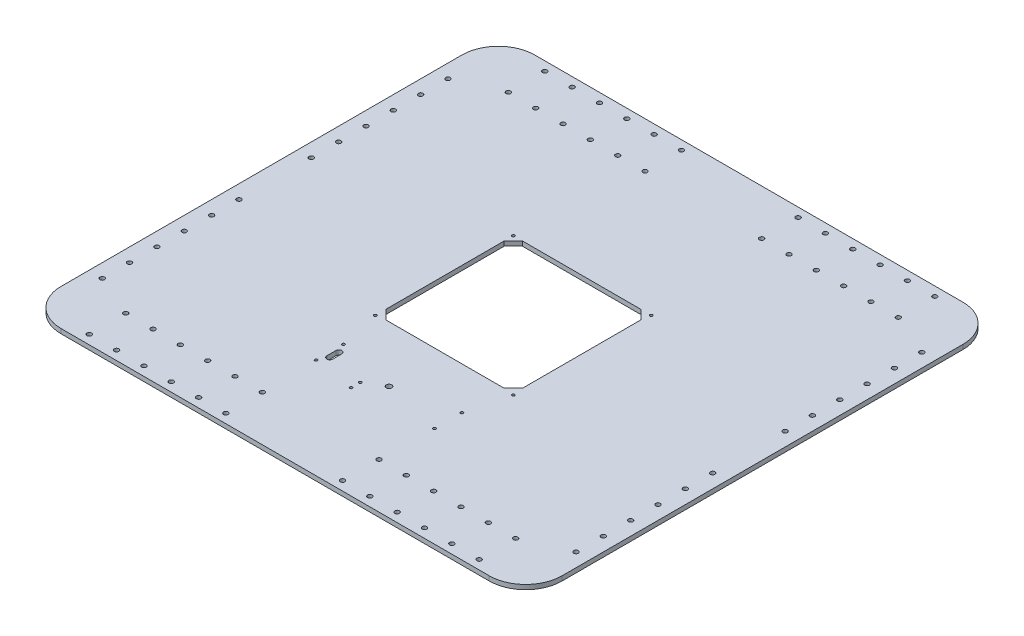
from build123d import *

# Parameters (mm, degrees)
SKETCH1_R           = 2.999999999
SKETCH1_R_2         = 1.5
SKETCH1_R_3         = 1.499999999
BOSS_EXTRUDE1_DEPTH = 5
SKETCH4_R           = 2.5
CUT_EXTRUDE1_DEPTH  = 757.918093325


with BuildPart() as part:
    # Sketch1 → Boss-Extrude1 (new body)
    with BuildSketch(Plane(origin=(0, 0, 0), x_dir=(1, 0, 0), z_dir=(0, 1, 0))):
        with BuildLine():
            Line((40, 0), (510.000000002, 0))
            ThreePointArc((510.000000002, 0), (538.28427125, 11.715728753), (550.000000002, 40))
            Line((550.000000002, 40), (550.000000002, 480))
            ThreePointArc((550.000000002, 480), (538.28427125, 508.284271247), (510.000000002, 520))
            Line((510.000000002, 520), (40, 520))
            ThreePointArc((40, 520), (11.715728753, 508.284271247), (0, 480))
            Line((0, 480), (0, 40))
            ThreePointArc((0, 40), (11.715728753, 11.715728753), (40, 0))
        make_face()
        with Locations(Location((275.000000001, 125, 0), (0, 0, 270))):
            Circle(SKETCH1_R, mode=Mode.SUBTRACT)
        with Locations(Location((200.000000001, 336.45643718, 0), (0, 0, 270))):
            Circle(SKETCH1_R_2, mode=Mode.SUBTRACT)
        with Locations(Location((351.456437186, 336.45643718, 0), (0, 0, 270))):
            Circle(SKETCH1_R_2, mode=Mode.SUBTRACT)
        with Locations(Location((351.456437186, 184.999999996, 0), (0, 0, 270))):
            Circle(SKETCH1_R_2, mode=Mode.SUBTRACT)
        with Locations(Location((200.000000001, 184.999999996, 0), (0, 0, 270))):
            Circle(SKETCH1_R_2, mode=Mode.SUBTRACT)
        with Locations(Location((255.405759863, 113, 0), (0, 0, 270))):
            Circle(SKETCH1_R_2, mode=Mode.SUBTRACT)
        with Locations(Location((210.000000001, 110, 0), (0, 0, 270))):
            Circle(SKETCH1_R_3, mode=Mode.SUBTRACT)
        with Locations(Location((255.405759863, 103, 0), (0, 0, 270))):
            Circle(SKETCH1_R_2, mode=Mode.SUBTRACT)
        with Locations(Location((340.000000001, 140, 0), (0, 0, 270))):
            Circle(SKETCH1_R_3, mode=Mode.SUBTRACT)
        with Locations(Location((210.000000001, 140, 0), (0, 0, 270))):
            Circle(SKETCH1_R_3, mode=Mode.SUBTRACT)
        with Locations(Location((340.000000001, 110, 0), (0, 0, 270))):
            Circle(SKETCH1_R_3, mode=Mode.SUBTRACT)
        Polygon((200.000000001, 326.45643718), (210.000000001, 336.45643718), (340.000000001, 336.45643718), (350.000000001, 326.45643718), (350.000000001, 196.45643718), (340.000000001, 186.45643718), (210.000000001, 186.45643718), (200.000000001, 196.45643718), align=None, mode=Mode.SUBTRACT)
        with BuildLine():
            Line((218.220285237, 120), (218.220285237, 130))
            ThreePointArc((218.220285237, 130), (215.000000001, 133.220285235), (211.779714766, 130))
            Line((211.779714766, 130), (211.779714766, 120))
            ThreePointArc((211.779714766, 120), (215.000000001, 116.779714765), (218.220285237, 120))
        make_face(mode=Mode.SUBTRACT)
    extrude(amount=BOSS_EXTRUDE1_DEPTH)

    # Sketch4 → Cut-Extrude1 (cut, through all)
    with BuildSketch(Plane(origin=(0, 5, 0), x_dir=(1, 0, 0), z_dir=(0, 1, 0))):
        with Locations(Location((535, 70.266316246, 0), (0, 0, 90))):
            Circle(SKETCH4_R)
        with Locations(Location((488.994609259, 10, 0), (0, 0, 90))):
            Circle(SKETCH4_R)
        with Locations(Location((488.994609259, 50, 0), (0, 0, 90))):
            Circle(SKETCH4_R)
        with Locations(Location((535, 100.266316246, 0), (0, 0, 90))):
            Circle(SKETCH4_R)
        with Locations(Location((535, 130.266316246, 0), (0, 0, 90))):
            Circle(SKETCH4_R)
        with Locations(Location((535, 160.266316246, 0), (0, 0, 90))):
            Circle(SKETCH4_R)
        with Locations(Location((535, 190.266316246, 0), (0, 0, 90))):
            Circle(SKETCH4_R)
        with Locations(Location((535, 220.266316246, 0), (0, 0, 90))):
            Circle(SKETCH4_R)
        with Locations(Location((458.994609259, 50, 0), (0, 0, 90))):
            Circle(SKETCH4_R)
        with Locations(Location((458.994609259, 10, 0), (0, 0, 90))):
            Circle(SKETCH4_R)
        with Locations(Location((428.994609259, 50, 0), (0, 0, 90))):
            Circle(SKETCH4_R)
        with Locations(Location((428.994609259, 10, 0), (0, 0, 90))):
            Circle(SKETCH4_R)
        with Locations(Location((398.994609259, 50, 0), (0, 0, 90))):
            Circle(SKETCH4_R)
        with Locations(Location((398.994609259, 10, 0), (0, 0, 90))):
            Circle(SKETCH4_R)
        with Locations(Location((368.994609259, 50, 0), (0, 0, 90))):
            Circle(SKETCH4_R)
        with Locations(Location((368.994609259, 10, 0), (0, 0, 90))):
            Circle(SKETCH4_R)
        with Locations(Location((338.994609259, 50, 0), (0, 0, 90))):
            Circle(SKETCH4_R)
        with Locations(Location((338.994609259, 10, 0), (0, 0, 90))):
            Circle(SKETCH4_R)
        with Locations(Location((338.994609259, 510, 0), (0, 0, 270))):
            Circle(SKETCH4_R)
        with Locations(Location((338.994609259, 470, 0), (0, 0, 270))):
            Circle(SKETCH4_R)
        with Locations(Location((368.994609259, 510, 0), (0, 0, 270))):
            Circle(SKETCH4_R)
        with Locations(Location((368.994609259, 470, 0), (0, 0, 270))):
            Circle(SKETCH4_R)
        with Locations(Location((398.994609259, 510, 0), (0, 0, 270))):
            Circle(SKETCH4_R)
        with Locations(Location((398.994609259, 470, 0), (0, 0, 270))):
            Circle(SKETCH4_R)
        with Locations(Location((428.994609259, 510, 0), (0, 0, 270))):
            Circle(SKETCH4_R)
        with Locations(Location((428.994609259, 470, 0), (0, 0, 270))):
            Circle(SKETCH4_R)
        with Locations(Location((458.994609259, 510, 0), (0, 0, 270))):
            Circle(SKETCH4_R)
        with Locations(Location((458.994609259, 470, 0), (0, 0, 270))):
            Circle(SKETCH4_R)
        with Locations(Location((535, 299.733683754, 0), (0, 0, 270))):
            Circle(SKETCH4_R)
        with Locations(Location((535, 329.733683754, 0), (0, 0, 270))):
            Circle(SKETCH4_R)
        with Locations(Location((535, 359.733683754, 0), (0, 0, 270))):
            Circle(SKETCH4_R)
        with Locations(Location((535, 389.733683754, 0), (0, 0, 270))):
            Circle(SKETCH4_R)
        with Locations(Location((535, 419.733683754, 0), (0, 0, 270))):
            Circle(SKETCH4_R)
        with Locations(Location((488.994609259, 470, 0), (0, 0, 270))):
            Circle(SKETCH4_R)
        with Locations(Location((488.994609259, 510, 0), (0, 0, 270))):
            Circle(SKETCH4_R)
        with Locations(Location((535, 449.733683754, 0), (0, 0, 270))):
            Circle(SKETCH4_R)
        with Locations(Location((211.005390743, 10, 0), (0, 0, 270))):
            Circle(SKETCH4_R)
        with Locations(Location((211.005390743, 50, 0), (0, 0, 270))):
            Circle(SKETCH4_R)
        with Locations(Location((181.005390743, 10, 0), (0, 0, 270))):
            Circle(SKETCH4_R)
        with Locations(Location((181.005390743, 50, 0), (0, 0, 270))):
            Circle(SKETCH4_R)
        with Locations(Location((151.005390743, 10, 0), (0, 0, 270))):
            Circle(SKETCH4_R)
        with Locations(Location((151.005390743, 50, 0), (0, 0, 270))):
            Circle(SKETCH4_R)
        with Locations(Location((121.005390743, 10, 0), (0, 0, 270))):
            Circle(SKETCH4_R)
        with Locations(Location((121.005390743, 50, 0), (0, 0, 270))):
            Circle(SKETCH4_R)
        with Locations(Location((91.005390743, 10, 0), (0, 0, 270))):
            Circle(SKETCH4_R)
        with Locations(Location((91.005390743, 50, 0), (0, 0, 270))):
            Circle(SKETCH4_R)
        with Locations(Location((15.000000002, 220.266316246, 0), (0, 0, 270))):
            Circle(SKETCH4_R)
        with Locations(Location((15.000000002, 190.266316246, 0), (0, 0, 270))):
            Circle(SKETCH4_R)
        with Locations(Location((15.000000002, 160.266316246, 0), (0, 0, 270))):
            Circle(SKETCH4_R)
        with Locations(Location((15.000000002, 130.266316246, 0), (0, 0, 270))):
            Circle(SKETCH4_R)
        with Locations(Location((15.000000002, 100.266316246, 0), (0, 0, 270))):
            Circle(SKETCH4_R)
        with Locations(Location((61.005390743, 50, 0), (0, 0, 270))):
            Circle(SKETCH4_R)
        with Locations(Location((61.005390743, 10, 0), (0, 0, 270))):
            Circle(SKETCH4_R)
        with Locations(Location((15.000000002, 70.266316246, 0), (0, 0, 270))):
            Circle(SKETCH4_R)
        with Locations(Location((15.000000002, 449.733683754, 0), (0, 0, 90))):
            Circle(SKETCH4_R)
        with Locations(Location((61.005390743, 510, 0), (0, 0, 90))):
            Circle(SKETCH4_R)
        with Locations(Location((61.005390743, 470, 0), (0, 0, 90))):
            Circle(SKETCH4_R)
        with Locations(Location((15.000000002, 419.733683754, 0), (0, 0, 90))):
            Circle(SKETCH4_R)
        with Locations(Location((15.000000002, 389.733683754, 0), (0, 0, 90))):
            Circle(SKETCH4_R)
        with Locations(Location((15.000000002, 359.733683754, 0), (0, 0, 90))):
            Circle(SKETCH4_R)
        with Locations(Location((15.000000002, 329.733683754, 0), (0, 0, 90))):
            Circle(SKETCH4_R)
        with Locations(Location((15.000000002, 299.733683754, 0), (0, 0, 90))):
            Circle(SKETCH4_R)
        with Locations(Location((91.005390743, 470, 0), (0, 0, 90))):
            Circle(SKETCH4_R)
        with Locations(Location((91.005390743, 510, 0), (0, 0, 90))):
            Circle(SKETCH4_R)
        with Locations(Location((121.005390743, 470, 0), (0, 0, 90))):
            Circle(SKETCH4_R)
        with Locations(Location((121.005390743, 510, 0), (0, 0, 90))):
            Circle(SKETCH4_R)
        with Locations(Location((151.005390743, 470, 0), (0, 0, 90))):
            Circle(SKETCH4_R)
        with Locations(Location((151.005390743, 510, 0), (0, 0, 90))):
            Circle(SKETCH4_R)
        with Locations(Location((181.005390743, 470, 0), (0, 0, 90))):
            Circle(SKETCH4_R)
        with Locations(Location((181.005390743, 510, 0), (0, 0, 90))):
            Circle(SKETCH4_R)
        with Locations(Location((211.005390743, 470, 0), (0, 0, 90))):
            Circle(SKETCH4_R)
        with Locations(Location((211.005390743, 510, 0), (0, 0, 90))):
            Circle(SKETCH4_R)
    extrude(amount=-CUT_EXTRUDE1_DEPTH, mode=Mode.SUBTRACT)


solid = part.part
